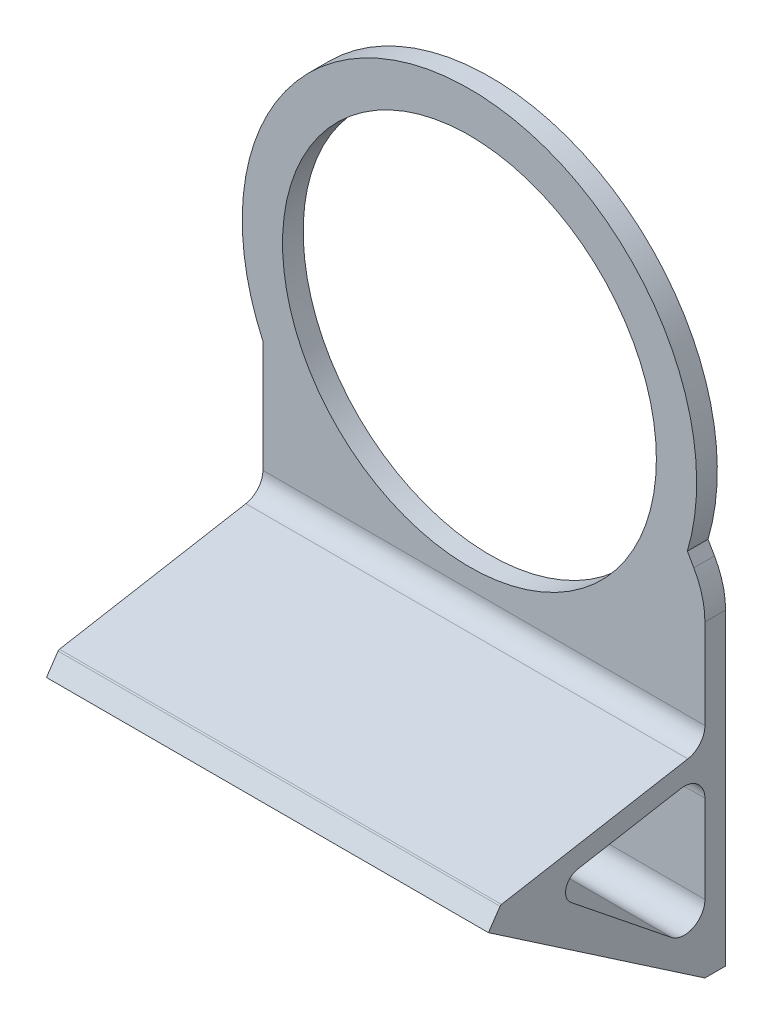
from build123d import *

# Parameters (mm, degrees)
ESQUISSE1_R                    = 55
ESQUISSE1_R_2                  = 45.25
BOSS_EXTRU_1_DEPTH             = 5
BOSS_EXTRU_2_DEPTH             = 5
BOSS_EXTRU_3_REACH             = 118.795
BOSS_EXTRU_3_DIRECTION_2_REACH = 118.795
CONG_1_R                       = 5
CONG_2_R                       = 5
CONG_3_R                       = 5
BOSS_EXTRU_4_DEPTH             = 7
BOSS_EXTRU_5_DEPTH             = 5
CONG_7_R                       = 20


with BuildPart() as part:
    # Esquisse1 → Boss.-Extru.1 (new body)
    with BuildSketch(Plane.XY):
        Circle(ESQUISSE1_R)
        Circle(ESQUISSE1_R_2, mode=Mode.SUBTRACT)
    extrude(amount=BOSS_EXTRU_1_DEPTH)

    # Esquisse2 → Boss.-Extru.2 (add)
    with BuildSketch(Plane(origin=(0, 0, 0), x_dir=(-1, 0, 0), z_dir=(0, 0, -1))):
        with BuildLine():
            Line((-50, -22.912878475), (-50, -102.912878475))
            Line((-50, -102.912878475), (50, -102.912878475))
            Line((50, -102.912878475), (50, -22.912878475))
            ThreePointArc((50, -22.912878475), (0, -55), (-50, -22.912878475))
        make_face()
    extrude(amount=-BOSS_EXTRU_2_DEPTH)

    # Boss.-Extru.3: up to this face of the body (flat: up to its plane)
    boss_extru_3_end = Plane(part.part.faces().sort_by_distance((50, -62.912878475, 2.5))[0])
    # Esquisse3 → Boss.-Extru.3 (add, up to the picked face)
    with BuildSketch(Plane(origin=(0, 0, 0), x_dir=(0, 0, -1), z_dir=(1, 0, 0)), mode=Mode.PRIVATE) as boss_extru_3_sk1:
        with BuildLine():
            Line((-5, -102.912878475), (-57.400351245, -67.211308793))
            Line((-57.400351245, -67.211308793), (-54.585063802, -63.079220143))
            ThreePointArc((-54.585063802, -63.079220143), (-54.440259998, -62.937915144), (-54.251927212, -62.863982707))
            Line((-54.251927212, -62.863982707), (-5, -54.179539087))
            Line((-5, -54.179539087), (-5, -59.256672147))
            Line((-5, -59.256672147), (-35.834324462, -64.693595481))
            ThreePointArc((-35.834324462, -64.693595481), (-38.617179929, -67.272281909), (-37.416008291, -70.871044883))
            Line((-37.416008291, -70.871044883), (-5, -96.86266946))
            Line((-5, -96.86266946), (-5, -102.912878475))
        make_face()
    boss_extru_3_tool1 = split(extrude(boss_extru_3_sk1.sketch, amount=BOSS_EXTRU_3_REACH, mode=Mode.PRIVATE), bisect_by=boss_extru_3_end, keep=Keep.BOTH, mode=Mode.PRIVATE)
    add(boss_extru_3_tool1.solids().sort_by(Axis((0, -84.470715, 30.797256), (1, 0, 0)))[0])

    # Boss.-Extru.3 direction 2: up to this face of the body (flat: up to its plane)
    boss_extru_3_direction_2_end = Plane(part.part.faces().sort_by_distance((-50, -62.912878475, 2.5))[0])
    # Esquisse3 → Boss.-Extru.3 direction 2 (add, up to the picked face)
    with BuildSketch(Plane(origin=(0, 0, 0), x_dir=(0, 0, -1), z_dir=(1, 0, 0)), mode=Mode.PRIVATE) as boss_extru_3_direction_2_sk1:
        with BuildLine():
            Line((-5, -102.912878475), (-57.400351245, -67.211308793))
            Line((-57.400351245, -67.211308793), (-54.585063802, -63.079220143))
            ThreePointArc((-54.585063802, -63.079220143), (-54.440259998, -62.937915144), (-54.251927212, -62.863982707))
            Line((-54.251927212, -62.863982707), (-5, -54.179539087))
            Line((-5, -54.179539087), (-5, -59.256672147))
            Line((-5, -59.256672147), (-35.834324462, -64.693595481))
            ThreePointArc((-35.834324462, -64.693595481), (-38.617179929, -67.272281909), (-37.416008291, -70.871044883))
            Line((-37.416008291, -70.871044883), (-5, -96.86266946))
            Line((-5, -96.86266946), (-5, -102.912878475))
        make_face()
    boss_extru_3_direction_2_tool1 = split(extrude(boss_extru_3_direction_2_sk1.sketch, amount=-BOSS_EXTRU_3_DIRECTION_2_REACH, mode=Mode.PRIVATE), bisect_by=boss_extru_3_direction_2_end, keep=Keep.BOTH, mode=Mode.PRIVATE)
    add(boss_extru_3_direction_2_tool1.solids().sort_by(Axis((0, -84.470715, 30.797256), (-1, 0, 0)))[0])

    # Congé1
    cong_1_edges = [part.edges().sort_by_distance(p)[0] for p in [
        (0, -59.256672147, 5),
    ]]
    fillet(cong_1_edges, radius=CONG_1_R)

    # Congé2
    cong_2_edges = [part.edges().sort_by_distance(p)[0] for p in [
        (0, -54.179539087, 5),
    ]]
    fillet(cong_2_edges, radius=CONG_2_R)

    # Congé3
    cong_3_edges = [part.edges().sort_by_distance(p)[0] for p in [
        (0, -96.86266946, 5),
    ]]
    fillet(cong_3_edges, radius=CONG_3_R)

    # Esquisse5 → Boss.-Extru.4 (add)
    with BuildSketch(Plane(origin=(50, 0, 0), x_dir=(0, 0, -1), z_dir=(1, 0, 0))):
        with BuildLine():
            Line((-9.131759112, -54.908079696), (-54.251927212, -62.863982707))
            ThreePointArc((-54.251927212, -62.863982707), (-54.440259998, -62.937915144), (-54.585063802, -63.079220143))
            Line((-54.585063802, -63.079220143), (-57.400351245, -67.211308793))
            Line((-57.400351245, -67.211308793), (-5, -102.912878475))
            Line((-5, -102.912878475), (0, -102.912878475))
            Line((0, -102.912878475), (0, -22.912878475))
            Line((0, -22.912878475), (-5, -22.912878475))
            Line((-5, -22.912878475), (-5, -49.984040931))
            ThreePointArc((-5, -49.984040931), (-6.169777784, -53.19797898), (-9.131759112, -54.908079696))
        make_face()
        with BuildLine():
            Line((-35.834324462, -64.693595481), (-10.868240888, -60.291401345))
            ThreePointArc((-10.868240888, -60.291401345), (-6.786061952, -61.385217894), (-5, -65.21544011))
            Line((-5, -65.21544011), (-5, -86.444801488))
            ThreePointArc((-5, -86.444801488), (-7.836547445, -90.952514105), (-13.127789216, -90.34569044))
            Line((-13.127789216, -90.34569044), (-37.416008291, -70.871044883))
            ThreePointArc((-37.416008291, -70.871044883), (-38.617179929, -67.272281909), (-35.834324462, -64.693595481))
        make_face(mode=Mode.SUBTRACT)
    extrude(amount=BOSS_EXTRU_4_DEPTH)

    # Esquisse6 → Boss.-Extru.5 (add, through all)
    with BuildSketch(Plane.XY.offset(5)):
        with BuildLine():
            Line((57, -22.912878475), (52.753659593, -15.558001143))
            ThreePointArc((52.753659593, -15.558001143), (51.508273074, -19.284652056), (50, -22.912878475))
            Line((50, -22.912878475), (57, -22.912878475))
        make_face()
    extrude(amount=-BOSS_EXTRU_5_DEPTH)

    # Congé7
    cong_7_edges = [part.edges().sort_by_distance(p)[0] for p in [
        (57, -22.912878475, 2.5),
    ]]
    fillet(cong_7_edges, radius=CONG_7_R)


solid = part.part
